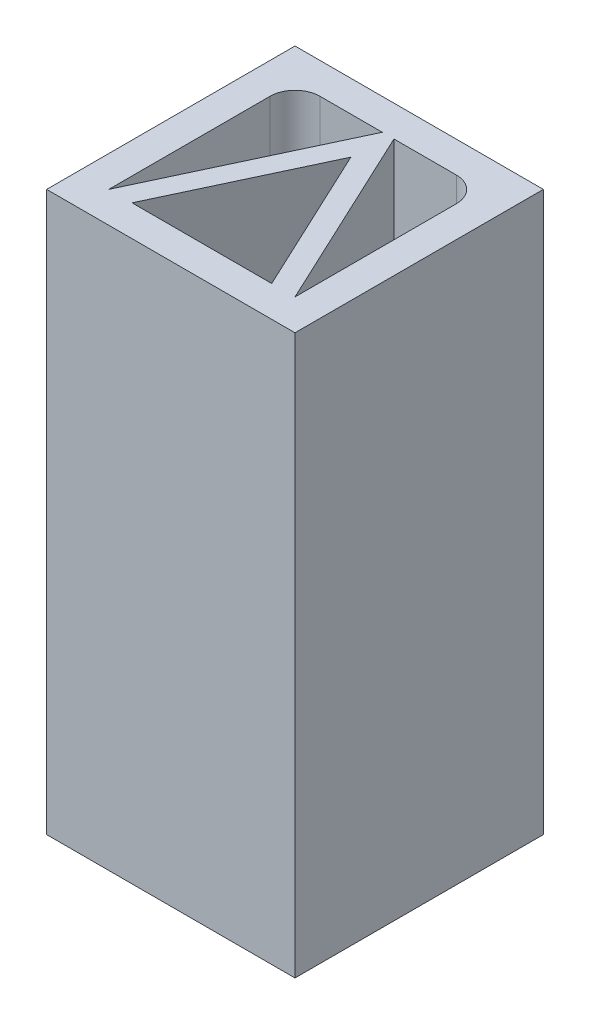
from build123d import *

# Parameters (mm, degrees)
SKETCH1_W           = 20
SKETCH1_H           = 20
SKETCH1_W_2         = 15
SKETCH1_H_2         = 15
BOSS_EXTRUDE1_DEPTH = 45
BOSS_EXTRUDE4_DEPTH = 45
FILLET2_R           = 2


with BuildPart() as part:
    # Sketch1 → Boss-Extrude1 (new body)
    with BuildSketch(Plane(origin=(0, 0, 0), x_dir=(1, 0, 0), z_dir=(0, 1, 0))):
        with Locations((10, 10)):
            Rectangle(SKETCH1_W, SKETCH1_H)
        with Locations((10, 10)):
            Rectangle(SKETCH1_W_2, SKETCH1_H_2, mode=Mode.SUBTRACT)
    extrude(amount=BOSS_EXTRUDE1_DEPTH)

    # Sketch3 → Boss-Extrude4 (add, through all)
    with BuildSketch(Plane.XZ):
        Polygon((17.5, -2.5), (10, -18.5), (2.5, -2.5), (4.375, -2.5), (10, -14.5), (15.625, -2.5), align=None)
    extrude(amount=-BOSS_EXTRUDE4_DEPTH)

    # Fillet2
    fillet2_edges = [part.edges().sort_by_distance(p)[0] for p in [
        (2.5, 22.5, -17.5),
        (17.5, 22.5, -17.5),
    ]]
    fillet(fillet2_edges, radius=FILLET2_R)


solid = part.part
